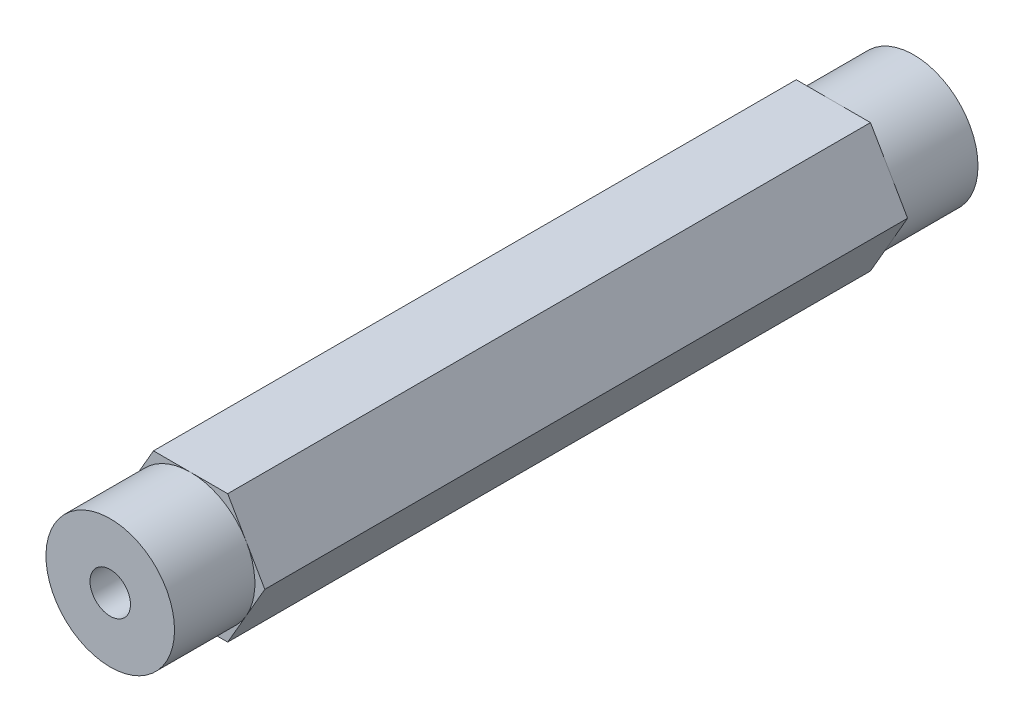
from build123d import *

# Parameters (mm, degrees)
SKETCH1_R               = 2.000000064
BOSS_EXTRUDE1_DEPTH     = 39.6875
SKETCH2_R               = 8.89
SKETCH2_R_2             = 6.35
CUT_EXTRUDE_THIN1_DEPTH = 7.9375


with BuildPart() as part:
    # Sketch1 → Boss-Extrude1 (new, symmetric)
    with BuildSketch(Plane.XY):
        Polygon((7.332348419, 0), (3.666174209, 6.35), (-3.666174209, 6.35), (-7.332348419, 0), (-3.666174209, -6.35), (3.666174209, -6.35), align=None)
        with Locations(Location((0, 0, 0), (0, 0, 180))):
            Circle(SKETCH1_R, mode=Mode.SUBTRACT)
    extrude(amount=BOSS_EXTRUDE1_DEPTH, both=True)

    # Sketch2 → Cut-Extrude-Thin1 (cut)
    with BuildSketch(Plane.XY.offset(31.75)):
        Circle(SKETCH2_R)
        Circle(SKETCH2_R_2, mode=Mode.SUBTRACT)
    cut_extrude_thin1 = extrude(amount=CUT_EXTRUDE_THIN1_DEPTH, mode=Mode.SUBTRACT)

    # Mirror1: Cut-Extrude-Thin1 across plane
    add(cut_extrude_thin1.mirror(Plane.XY), mode=Mode.SUBTRACT)


solid = part.part
